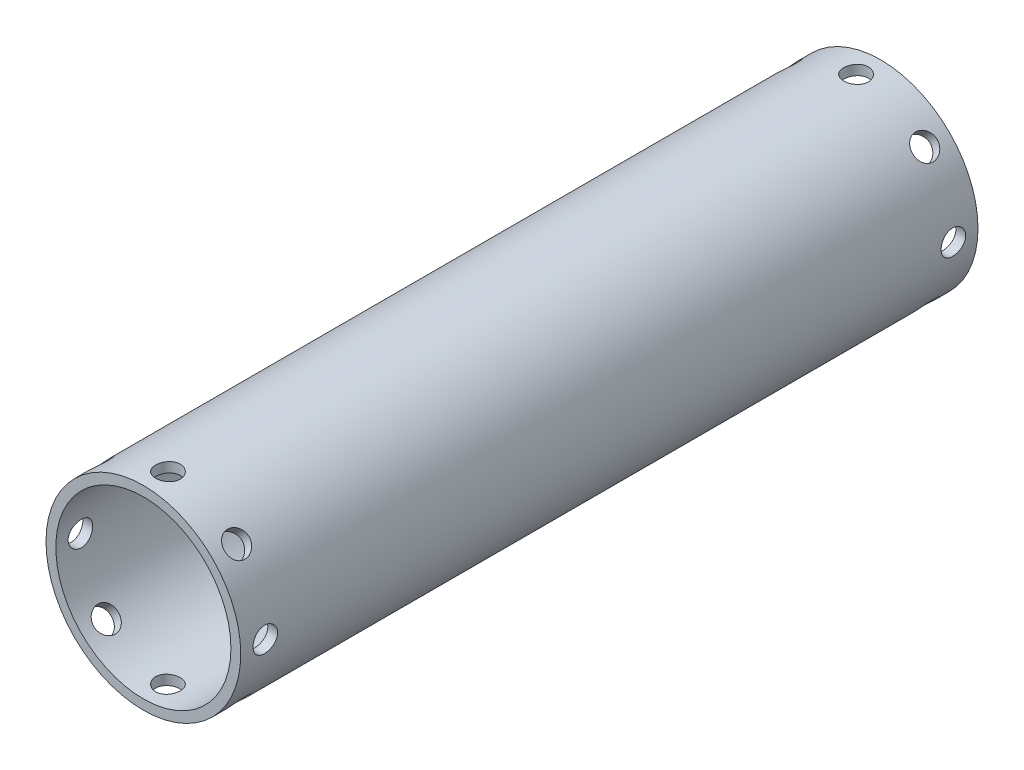
from build123d import *

# Parameters (mm, degrees)
ESBO_O1_R                = 15.85
ESBO_O1_R_2              = 14.25
RESSALTO_EXTRUS_O1_DEPTH = 120
CORTE_EXTRUS_O1_REACH    = 127.124
ESBO_O2_R                = 2
PADR_OCIRCULAR1_COUNT    = 8


with BuildPart() as part:
    # Esboço1 → Ressalto-extrusão1 (new body)
    with BuildSketch(Plane.XY):
        Circle(ESBO_O1_R)
        Circle(ESBO_O1_R_2, mode=Mode.SUBTRACT)
    extrude(amount=RESSALTO_EXTRUS_O1_DEPTH)

    # Esboço2 → Corte-extrusão1 (cut, up to next)
    with BuildSketch(Plane(origin=(-15.85, 0, 0), x_dir=(0, 0, -1), z_dir=(1, 0, 0)), mode=Mode.PRIVATE) as corte_extrus_o1_sk1:
        with Locations((-4, 0)):
            Circle(ESBO_O2_R)
    corte_extrus_o1_tool1 = extrude(corte_extrus_o1_sk1.sketch, amount=CORTE_EXTRUS_O1_REACH, mode=Mode.PRIVATE) & part.part
    # Esboço2 → Corte-extrusão1 (cut, up to next)
    with BuildSketch(Plane(origin=(-15.85, 0, 0), x_dir=(0, 0, -1), z_dir=(1, 0, 0)), mode=Mode.PRIVATE) as corte_extrus_o1_sk2:
        with Locations((-116, 0)):
            Circle(ESBO_O2_R)
    corte_extrus_o1_tool2 = extrude(corte_extrus_o1_sk2.sketch, amount=CORTE_EXTRUS_O1_REACH, mode=Mode.PRIVATE) & part.part
    corte_extrus_o1_1 = corte_extrus_o1_tool1.solids().sort_by_distance((-15.85, 0, 4))[0]
    add(corte_extrus_o1_1, mode=Mode.SUBTRACT)
    corte_extrus_o1_2 = corte_extrus_o1_tool2.solids().sort_by_distance((-15.85, 0, 116))[0]
    add(corte_extrus_o1_2, mode=Mode.SUBTRACT)
    corte_extrus_o1 = corte_extrus_o1_1 + corte_extrus_o1_2  # Corte-extrusão1 as one shape, for the pattern or mirror that repeats it

    # PadrãoCircular1: Corte-extrusão1 ×8 about axis
    padr_ocircular1_axis = Axis((0, 0, 0), (0, 0, 1))
    for i in range(1, PADR_OCIRCULAR1_COUNT):
        add(corte_extrus_o1.rotate(padr_ocircular1_axis, i * 360 / PADR_OCIRCULAR1_COUNT), mode=Mode.SUBTRACT)


solid = part.part
